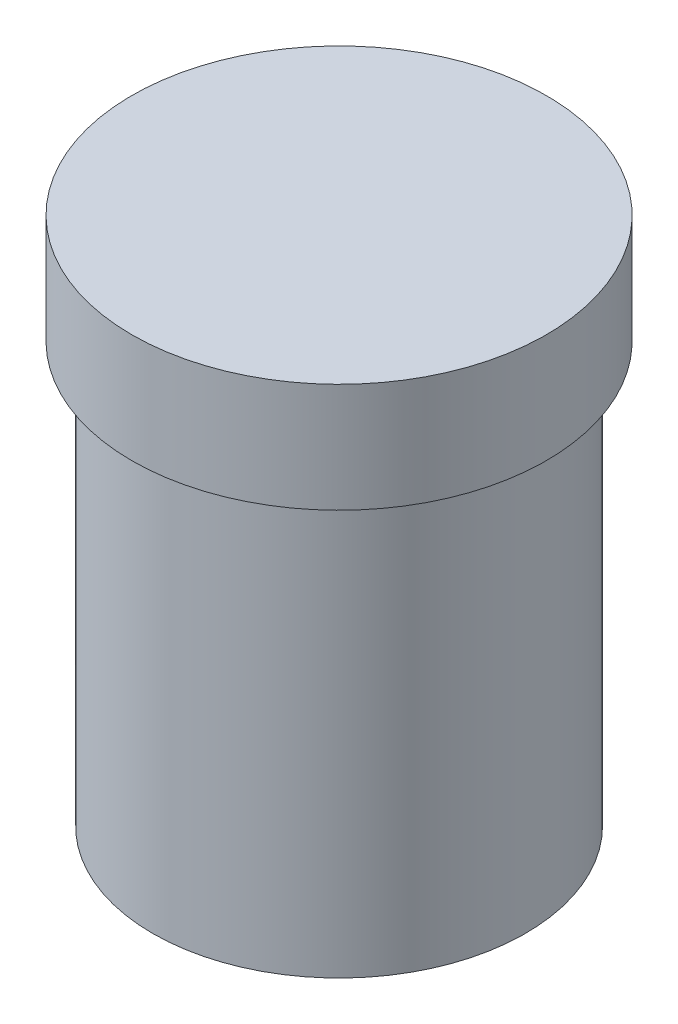
from build123d import *

# Parameters (mm, degrees)
SKETCH2_R           = 10.25
BOSS_EXTRUDE1_DEPTH = 23.1
SKETCH3_R           = 11.4
BOSS_EXTRUDE2_DEPTH = 6


with BuildPart() as part:
    # Sketch2 → Boss-Extrude1 (new body)
    with BuildSketch(Plane(origin=(0, 0, 0), x_dir=(1, 0, 0), z_dir=(0, 1, 0))):
        with Locations(Location((0, 0, 0), (0, 0, 270))):
            Circle(SKETCH2_R)
    extrude(amount=BOSS_EXTRUDE1_DEPTH)

    # Sketch3 → Boss-Extrude2 (add)
    with BuildSketch(Plane(origin=(0, 23.1, 0), x_dir=(1, 0, 0), z_dir=(0, 1, 0))):
        with Locations(Location((0, 0, 0), (0, 0, 270))):
            Circle(SKETCH3_R)
    extrude(amount=BOSS_EXTRUDE2_DEPTH)


solid = part.part
